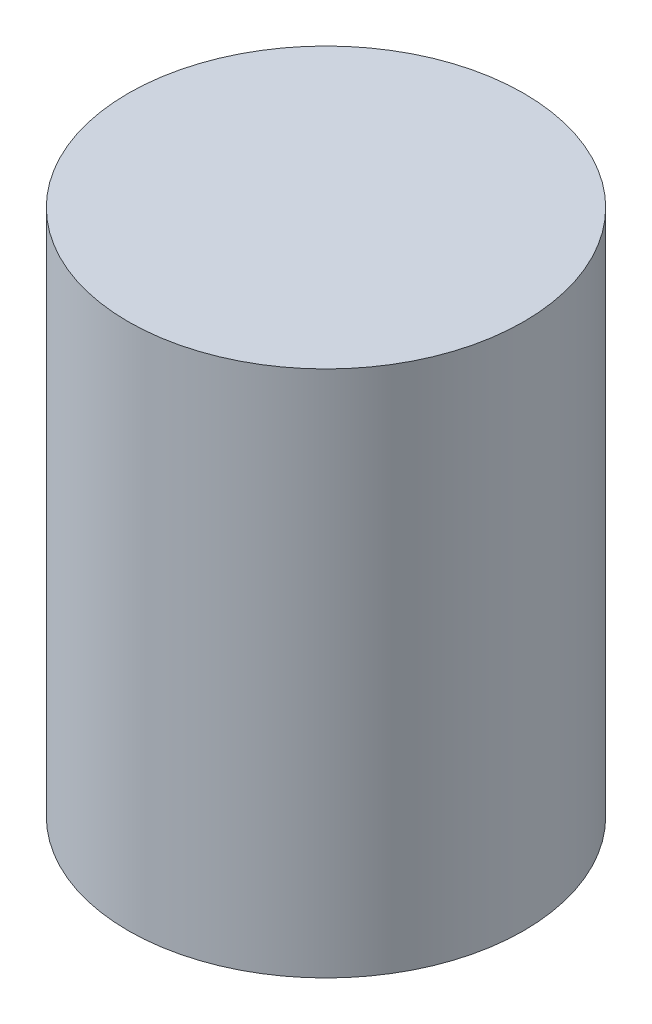
from build123d import *

# Parameters (mm, degrees)
SKETCH_1_R      = 30
EXTRUDE_1_DEPTH = 80


with BuildPart() as part:
    # 草圖1 → 填料-伸長1 (new body)
    with BuildSketch(Plane(origin=(0, 0, 0), x_dir=(1, 0, 0), z_dir=(0, 1, 0))):
        with Locations(Location((0, 0, 0), (0, 0, 270))):
            Circle(SKETCH_1_R)
    extrude(amount=EXTRUDE_1_DEPTH)


solid = part.part
